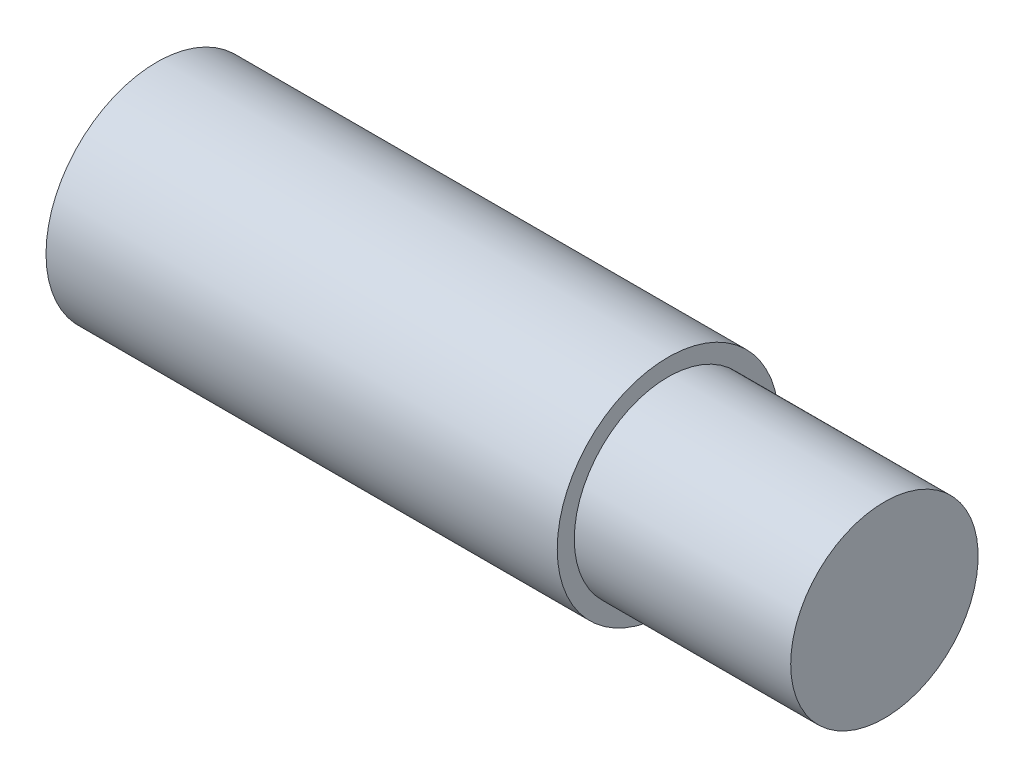
from build123d import *


with BuildPart() as part:
    # Fill_Nipple Sketch → Fill_Nipple (revolve)
    with BuildSketch(Plane.XY):
        Polygon((12.7, 0), (12.7, 5.5), (0, 5.5), (0, 6.5), (-30, 6.5), (-30, 0), align=None)
    revolve(axis=Axis((-1000, 0, 0), (1, 0, 0)))


solid = part.part
